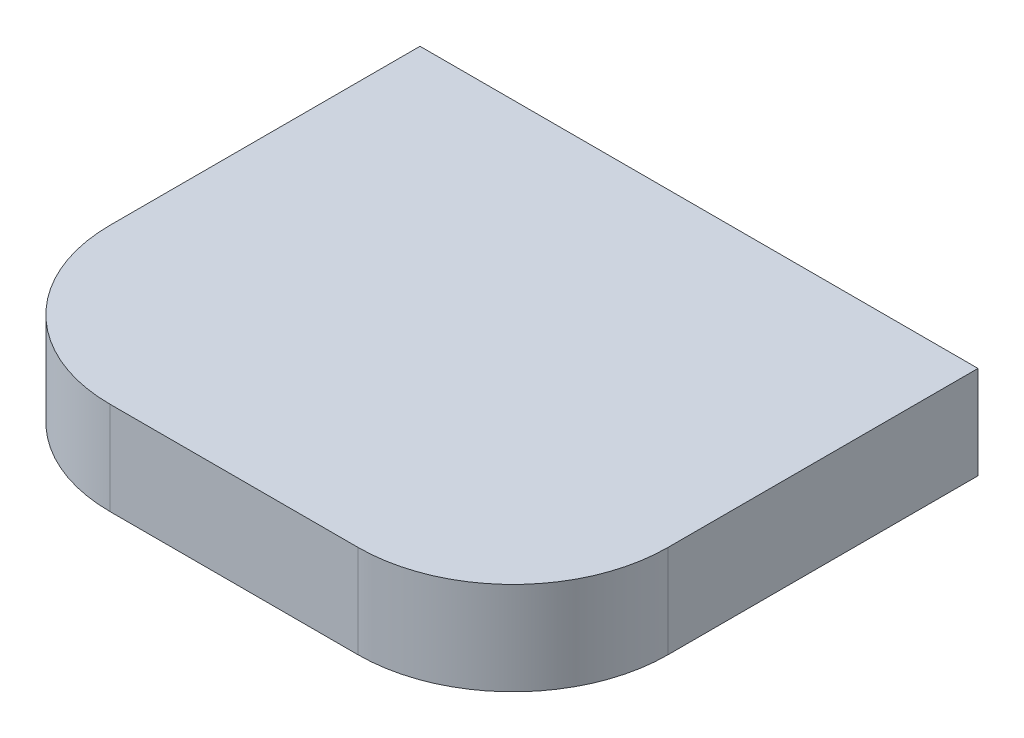
from build123d import *

# Parameters (mm, degrees)
BOSS_EXTRUDE1_DEPTH = 7.62


with BuildPart() as part:
    # Sketch1 → Boss-Extrude1 (new body)
    with BuildSketch(Plane(origin=(0, 0, 0), x_dir=(1, 0, 0), z_dir=(0, 1, 0))):
        with BuildLine():
            Line((22.86, 19.19), (-22.86, 19.19))
            Line((-22.86, 19.19), (-22.86, -6.21))
            ThreePointArc((-22.86, -6.21), (-19.140256121, -15.190256121), (-10.16, -18.91))
            Line((-10.16, -18.91), (10.16, -18.91))
            ThreePointArc((10.16, -18.91), (19.140256121, -15.190256121), (22.86, -6.21))
            Line((22.86, -6.21), (22.86, 19.19))
        make_face()
    extrude(amount=BOSS_EXTRUDE1_DEPTH)


solid = part.part
